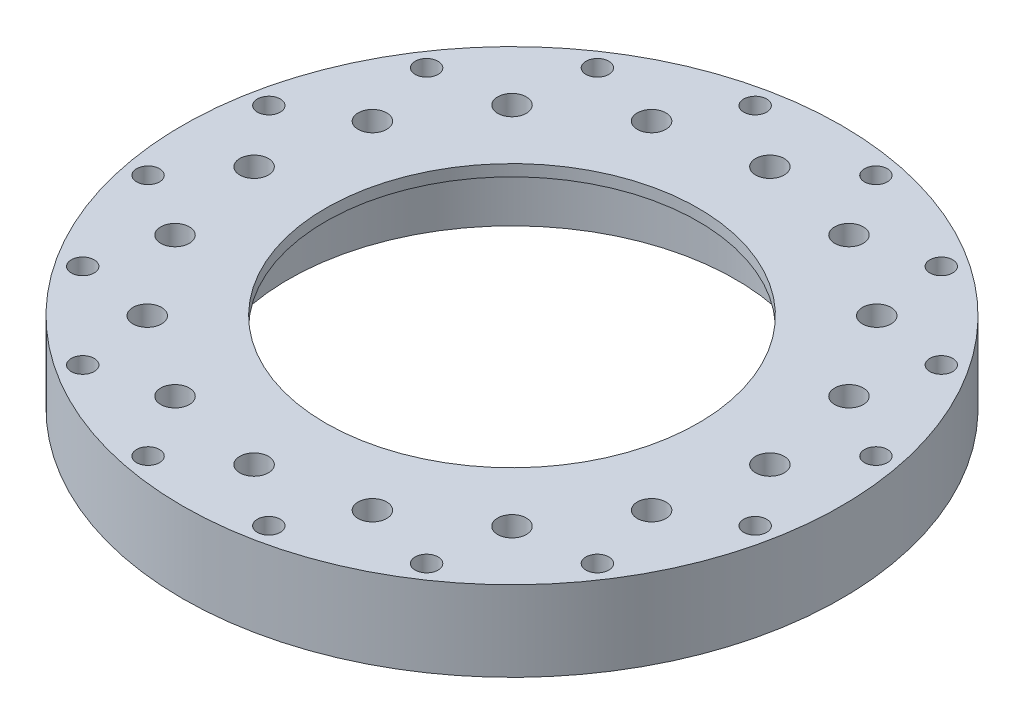
from build123d import *

# Parameters (mm, degrees)
SKETCH1_R           = 57.5
SKETCH1_R_2         = 39
SKETCH1_R_3         = 2
BOSS_EXTRUDE1_DEPTH = 12
SKETCH2_R           = 2.5
CUT_EXTRUDE1_DEPTH  = 10
SKETCH4_R           = 5
SKETCH4_R_2         = 2.5
BOSS_EXTRUDE3_DEPTH = 0.4
SKETCH6_R           = 57.5
SKETCH6_R_2         = 32.5
BOSS_EXTRUDE4_DEPTH = 2
CUT_EXTRUDE2_START  = -58
SKETCH7_R           = 2.5
SKETCH7_R_2         = 2
CUT_EXTRUDE2_DEPTH  = 58


with BuildPart() as part:
    # Sketch1 → Boss-Extrude1 (new body)
    with BuildSketch(Plane(origin=(0, 0, 0), x_dir=(1, 0, 0), z_dir=(0, 1, 0))):
        with Locations(Location((0, 0, 0), (0, 0, 270))):
            Circle(SKETCH1_R)
        with Locations(Location((0, 0, 0), (0, 0, 270))):
            Circle(SKETCH1_R_2, mode=Mode.SUBTRACT)
        with Locations(Location((-10.534877389, 52.962405142, 0), (0, 0, 270))):
            Circle(SKETCH1_R_3, mode=Mode.SUBTRACT)
        with Locations(Location((10.534877389, 52.962405142, 0), (0, 0, 270))):
            Circle(SKETCH1_R_3, mode=Mode.SUBTRACT)
        with Locations(Location((30.000792583, 44.899359064, 0), (0, 0, 270))):
            Circle(SKETCH1_R_3, mode=Mode.SUBTRACT)
        with Locations(Location((44.899359064, 30.000792583, 0), (0, 0, 270))):
            Circle(SKETCH1_R_3, mode=Mode.SUBTRACT)
        with Locations(Location((52.962405142, 10.534877389, 0), (0, 0, 270))):
            Circle(SKETCH1_R_3, mode=Mode.SUBTRACT)
        with Locations(Location((52.962405142, -10.534877389, 0), (0, 0, 270))):
            Circle(SKETCH1_R_3, mode=Mode.SUBTRACT)
        with Locations(Location((44.899359064, -30.000792583, 0), (0, 0, 270))):
            Circle(SKETCH1_R_3, mode=Mode.SUBTRACT)
        with Locations(Location((30.000792583, -44.899359064, 0), (0, 0, 270))):
            Circle(SKETCH1_R_3, mode=Mode.SUBTRACT)
        with Locations(Location((10.534877389, -52.962405142, 0), (0, 0, 270))):
            Circle(SKETCH1_R_3, mode=Mode.SUBTRACT)
        with Locations(Location((-10.534877389, -52.962405142, 0), (0, 0, 270))):
            Circle(SKETCH1_R_3, mode=Mode.SUBTRACT)
        with Locations(Location((-30.000792583, -44.899359064, 0), (0, 0, 270))):
            Circle(SKETCH1_R_3, mode=Mode.SUBTRACT)
        with Locations(Location((-44.899359064, -30.000792583, 0), (0, 0, 270))):
            Circle(SKETCH1_R_3, mode=Mode.SUBTRACT)
        with Locations(Location((-52.962405142, -10.534877389, 0), (0, 0, 270))):
            Circle(SKETCH1_R_3, mode=Mode.SUBTRACT)
        with Locations(Location((-52.962405142, 10.534877389, 0), (0, 0, 270))):
            Circle(SKETCH1_R_3, mode=Mode.SUBTRACT)
        with Locations(Location((-44.899359064, 30.000792583, 0), (0, 0, 270))):
            Circle(SKETCH1_R_3, mode=Mode.SUBTRACT)
        with Locations(Location((-30.000792583, 44.899359064, 0), (0, 0, 270))):
            Circle(SKETCH1_R_3, mode=Mode.SUBTRACT)
    extrude(amount=BOSS_EXTRUDE1_DEPTH)

    # Sketch2 → Cut-Extrude1 (cut)
    with BuildSketch(Plane(origin=(0, 12, 0), x_dir=(1, 0, 0), z_dir=(0, 1, 0))):
        with Locations(Location((0, 45, 0), (0, 0, 270))):
            Circle(SKETCH2_R)
        with Locations(Location((17.220754456, 41.574578963, 0), (0, 0, 270))):
            Circle(SKETCH2_R)
        with Locations(Location((31.819805153, 31.819805153, 0), (0, 0, 270))):
            Circle(SKETCH2_R)
        with Locations(Location((41.574578963, 17.220754456, 0), (0, 0, 270))):
            Circle(SKETCH2_R)
        with Locations(Location((45, 0, 0), (0, 0, 270))):
            Circle(SKETCH2_R)
        with Locations(Location((41.574578963, -17.220754456, 0), (0, 0, 270))):
            Circle(SKETCH2_R)
        with Locations(Location((31.819805153, -31.819805153, 0), (0, 0, 270))):
            Circle(SKETCH2_R)
        with Locations(Location((17.220754456, -41.574578963, 0), (0, 0, 270))):
            Circle(SKETCH2_R)
        with Locations(Location((0, -45, 0), (0, 0, 270))):
            Circle(SKETCH2_R)
        with Locations(Location((-17.220754456, -41.574578963, 0), (0, 0, 270))):
            Circle(SKETCH2_R)
        with Locations(Location((-31.819805153, -31.819805153, 0), (0, 0, 270))):
            Circle(SKETCH2_R)
        with Locations(Location((-41.574578963, -17.220754456, 0), (0, 0, 270))):
            Circle(SKETCH2_R)
        with Locations(Location((-45, 0, 0), (0, 0, 270))):
            Circle(SKETCH2_R)
        with Locations(Location((-41.574578963, 17.220754456, 0), (0, 0, 270))):
            Circle(SKETCH2_R)
        with Locations(Location((-31.819805153, 31.819805153, 0), (0, 0, 270))):
            Circle(SKETCH2_R)
        with Locations(Location((-17.220754456, 41.574578963, 0), (0, 0, 270))):
            Circle(SKETCH2_R)
    extrude(amount=-CUT_EXTRUDE1_DEPTH, mode=Mode.SUBTRACT)

    # Sketch4 → Boss-Extrude3 (add)
    # profile 1 of 16: a face of its own
    with BuildSketch(Plane(origin=(0, 0, 0), x_dir=(1, 0, 0), z_dir=(0, 1, 0))):
        with Locations(Location((0, 45, 0), (0, 0, 270))):
            Circle(SKETCH4_R)
        with Locations(Location((0, 45, 0), (0, 0, 270))):
            Circle(SKETCH4_R_2, mode=Mode.SUBTRACT)
    # profile 2 of 16: a face of its own
    with BuildSketch(Plane(origin=(0, 0, 0), x_dir=(1, 0, 0), z_dir=(0, 1, 0))):
        with Locations(Location((17.220754456, 41.574578963, 0), (0, 0, 270))):
            Circle(SKETCH4_R)
        with Locations(Location((17.220754456, 41.574578963, 0), (0, 0, 270))):
            Circle(SKETCH4_R_2, mode=Mode.SUBTRACT)
    # profile 3 of 16: a face of its own
    with BuildSketch(Plane(origin=(0, 0, 0), x_dir=(1, 0, 0), z_dir=(0, 1, 0))):
        with Locations(Location((31.819805153, 31.819805153, 0), (0, 0, 270))):
            Circle(SKETCH4_R)
        with Locations(Location((31.819805153, 31.819805153, 0), (0, 0, 270))):
            Circle(SKETCH4_R_2, mode=Mode.SUBTRACT)
    # profile 4 of 16: a face of its own
    with BuildSketch(Plane(origin=(0, 0, 0), x_dir=(1, 0, 0), z_dir=(0, 1, 0))):
        with Locations(Location((41.574578963, 17.220754456, 0), (0, 0, 270))):
            Circle(SKETCH4_R)
        with Locations(Location((41.574578963, 17.220754456, 0), (0, 0, 270))):
            Circle(SKETCH4_R_2, mode=Mode.SUBTRACT)
    # profile 5 of 16: a face of its own
    with BuildSketch(Plane(origin=(0, 0, 0), x_dir=(1, 0, 0), z_dir=(0, 1, 0))):
        with Locations(Location((45, 0, 0), (0, 0, 270))):
            Circle(SKETCH4_R)
        with Locations(Location((45, 0, 0), (0, 0, 270))):
            Circle(SKETCH4_R_2, mode=Mode.SUBTRACT)
    # profile 6 of 16: a face of its own
    with BuildSketch(Plane(origin=(0, 0, 0), x_dir=(1, 0, 0), z_dir=(0, 1, 0))):
        with Locations(Location((41.574578963, -17.220754456, 0), (0, 0, 270))):
            Circle(SKETCH4_R)
        with Locations(Location((41.574578963, -17.220754456, 0), (0, 0, 270))):
            Circle(SKETCH4_R_2, mode=Mode.SUBTRACT)
    # profile 7 of 16: a face of its own
    with BuildSketch(Plane(origin=(0, 0, 0), x_dir=(1, 0, 0), z_dir=(0, 1, 0))):
        with Locations(Location((31.819805153, -31.819805153, 0), (0, 0, 270))):
            Circle(SKETCH4_R)
        with Locations(Location((31.819805153, -31.819805153, 0), (0, 0, 270))):
            Circle(SKETCH4_R_2, mode=Mode.SUBTRACT)
    # profile 8 of 16: a face of its own
    with BuildSketch(Plane(origin=(0, 0, 0), x_dir=(1, 0, 0), z_dir=(0, 1, 0))):
        with Locations(Location((17.220754456, -41.574578963, 0), (0, 0, 270))):
            Circle(SKETCH4_R)
        with Locations(Location((17.220754456, -41.574578963, 0), (0, 0, 270))):
            Circle(SKETCH4_R_2, mode=Mode.SUBTRACT)
    # profile 9 of 16: a face of its own
    with BuildSketch(Plane(origin=(0, 0, 0), x_dir=(1, 0, 0), z_dir=(0, 1, 0))):
        with Locations(Location((0, -45, 0), (0, 0, 270))):
            Circle(SKETCH4_R)
        with Locations(Location((0, -45, 0), (0, 0, 270))):
            Circle(SKETCH4_R_2, mode=Mode.SUBTRACT)
    # profile 10 of 16: a face of its own
    with BuildSketch(Plane(origin=(0, 0, 0), x_dir=(1, 0, 0), z_dir=(0, 1, 0))):
        with Locations(Location((-17.220754456, -41.574578963, 0), (0, 0, 270))):
            Circle(SKETCH4_R)
        with Locations(Location((-17.220754456, -41.574578963, 0), (0, 0, 270))):
            Circle(SKETCH4_R_2, mode=Mode.SUBTRACT)
    # profile 11 of 16: a face of its own
    with BuildSketch(Plane(origin=(0, 0, 0), x_dir=(1, 0, 0), z_dir=(0, 1, 0))):
        with Locations(Location((-31.819805153, -31.819805153, 0), (0, 0, 270))):
            Circle(SKETCH4_R)
        with Locations(Location((-31.819805153, -31.819805153, 0), (0, 0, 270))):
            Circle(SKETCH4_R_2, mode=Mode.SUBTRACT)
    # profile 12 of 16: a face of its own
    with BuildSketch(Plane(origin=(0, 0, 0), x_dir=(1, 0, 0), z_dir=(0, 1, 0))):
        with Locations(Location((-41.574578963, -17.220754456, 0), (0, 0, 270))):
            Circle(SKETCH4_R)
        with Locations(Location((-41.574578963, -17.220754456, 0), (0, 0, 270))):
            Circle(SKETCH4_R_2, mode=Mode.SUBTRACT)
    # profile 13 of 16: a face of its own
    with BuildSketch(Plane(origin=(0, 0, 0), x_dir=(1, 0, 0), z_dir=(0, 1, 0))):
        with Locations(Location((-45, 0, 0), (0, 0, 270))):
            Circle(SKETCH4_R)
        with Locations(Location((-45, 0, 0), (0, 0, 270))):
            Circle(SKETCH4_R_2, mode=Mode.SUBTRACT)
    # profile 14 of 16: a face of its own
    with BuildSketch(Plane(origin=(0, 0, 0), x_dir=(1, 0, 0), z_dir=(0, 1, 0))):
        with Locations(Location((-41.574578963, 17.220754456, 0), (0, 0, 270))):
            Circle(SKETCH4_R)
        with Locations(Location((-41.574578963, 17.220754456, 0), (0, 0, 270))):
            Circle(SKETCH4_R_2, mode=Mode.SUBTRACT)
    # profile 15 of 16: a face of its own
    with BuildSketch(Plane(origin=(0, 0, 0), x_dir=(1, 0, 0), z_dir=(0, 1, 0))):
        with Locations(Location((-31.819805153, 31.819805153, 0), (0, 0, 270))):
            Circle(SKETCH4_R)
        with Locations(Location((-31.819805153, 31.819805153, 0), (0, 0, 270))):
            Circle(SKETCH4_R_2, mode=Mode.SUBTRACT)
    # profile 16 of 16: a face of its own
    with BuildSketch(Plane(origin=(0, 0, 0), x_dir=(1, 0, 0), z_dir=(0, 1, 0))):
        with Locations(Location((-17.220754456, 41.574578963, 0), (0, 0, 270))):
            Circle(SKETCH4_R)
        with Locations(Location((-17.220754456, 41.574578963, 0), (0, 0, 270))):
            Circle(SKETCH4_R_2, mode=Mode.SUBTRACT)
    extrude(amount=-BOSS_EXTRUDE3_DEPTH)

    # Sketch6 → Boss-Extrude4 (add)
    with BuildSketch(Plane(origin=(0, 12, 0), x_dir=(1, 0, 0), z_dir=(0, 1, 0))):
        with Locations(Location((0, 0, 0), (0, 0, 270))):
            Circle(SKETCH6_R)
        with Locations(Location((0, 0, 0), (0, 0, 270))):
            Circle(SKETCH6_R_2, mode=Mode.SUBTRACT)
    extrude(amount=BOSS_EXTRUDE4_DEPTH)

    # Sketch7 → Cut-Extrude2 (cut)
    with BuildSketch(Plane.XZ.offset(CUT_EXTRUDE2_START)):
        with Locations(Location((0, 45, 0), (0, 0, 90))):
            Circle(SKETCH7_R)
        with Locations(Location((17.220754456, 41.574578963, 0), (0, 0, 90))):
            Circle(SKETCH7_R)
        with Locations(Location((31.819805153, 31.819805153, 0), (0, 0, 90))):
            Circle(SKETCH7_R)
        with Locations(Location((41.574578963, 17.220754456, 0), (0, 0, 90))):
            Circle(SKETCH7_R)
        with Locations(Location((45, 0, 0), (0, 0, 90))):
            Circle(SKETCH7_R)
        with Locations(Location((41.574578963, -17.220754456, 0), (0, 0, 90))):
            Circle(SKETCH7_R)
        with Locations(Location((31.819805153, -31.819805153, 0), (0, 0, 90))):
            Circle(SKETCH7_R)
        with Locations(Location((17.220754456, -41.574578963, 0), (0, 0, 90))):
            Circle(SKETCH7_R)
        with Locations(Location((0, -45, 0), (0, 0, 90))):
            Circle(SKETCH7_R)
        with Locations(Location((-17.220754456, -41.574578963, 0), (0, 0, 90))):
            Circle(SKETCH7_R)
        with Locations(Location((-31.819805153, -31.819805153, 0), (0, 0, 90))):
            Circle(SKETCH7_R)
        with Locations(Location((-41.574578963, -17.220754456, 0), (0, 0, 90))):
            Circle(SKETCH7_R)
        with Locations(Location((-45, 0, 0), (0, 0, 90))):
            Circle(SKETCH7_R)
        with Locations(Location((-41.574578963, 17.220754456, 0), (0, 0, 90))):
            Circle(SKETCH7_R)
        with Locations(Location((-31.819805153, 31.819805153, 0), (0, 0, 90))):
            Circle(SKETCH7_R)
        with Locations(Location((-17.220754456, 41.574578963, 0), (0, 0, 90))):
            Circle(SKETCH7_R)
        with Locations(Location((30.000792583, 44.899359064, 0), (0, 0, 90))):
            Circle(SKETCH7_R_2)
        with Locations(Location((44.899359064, 30.000792583, 0), (0, 0, 90))):
            Circle(SKETCH7_R_2)
        with Locations(Location((52.962405142, 10.534877389, 0), (0, 0, 90))):
            Circle(SKETCH7_R_2)
        with Locations(Location((52.962405142, -10.534877389, 0), (0, 0, 90))):
            Circle(SKETCH7_R_2)
        with Locations(Location((44.899359064, -30.000792583, 0), (0, 0, 90))):
            Circle(SKETCH7_R_2)
        with Locations(Location((30.000792583, -44.899359064, 0), (0, 0, 90))):
            Circle(SKETCH7_R_2)
        with Locations(Location((10.534877389, -52.962405142, 0), (0, 0, 90))):
            Circle(SKETCH7_R_2)
        with Locations(Location((-10.534877389, -52.962405142, 0), (0, 0, 90))):
            Circle(SKETCH7_R_2)
        with Locations(Location((-30.000792583, -44.899359064, 0), (0, 0, 90))):
            Circle(SKETCH7_R_2)
        with Locations(Location((-44.899359064, -30.000792583, 0), (0, 0, 90))):
            Circle(SKETCH7_R_2)
        with Locations(Location((-52.962405142, -10.534877389, 0), (0, 0, 90))):
            Circle(SKETCH7_R_2)
        with Locations(Location((-52.962405142, 10.534877389, 0), (0, 0, 90))):
            Circle(SKETCH7_R_2)
        with Locations(Location((-44.899359064, 30.000792583, 0), (0, 0, 90))):
            Circle(SKETCH7_R_2)
        with Locations(Location((-30.000792583, 44.899359064, 0), (0, 0, 90))):
            Circle(SKETCH7_R_2)
        with Locations(Location((-10.534877389, 52.962405142, 0), (0, 0, 90))):
            Circle(SKETCH7_R_2)
        with Locations(Location((10.534877389, 52.962405142, 0), (0, 0, 90))):
            Circle(SKETCH7_R_2)
    extrude(amount=CUT_EXTRUDE2_DEPTH, mode=Mode.SUBTRACT)


solid = part.part
